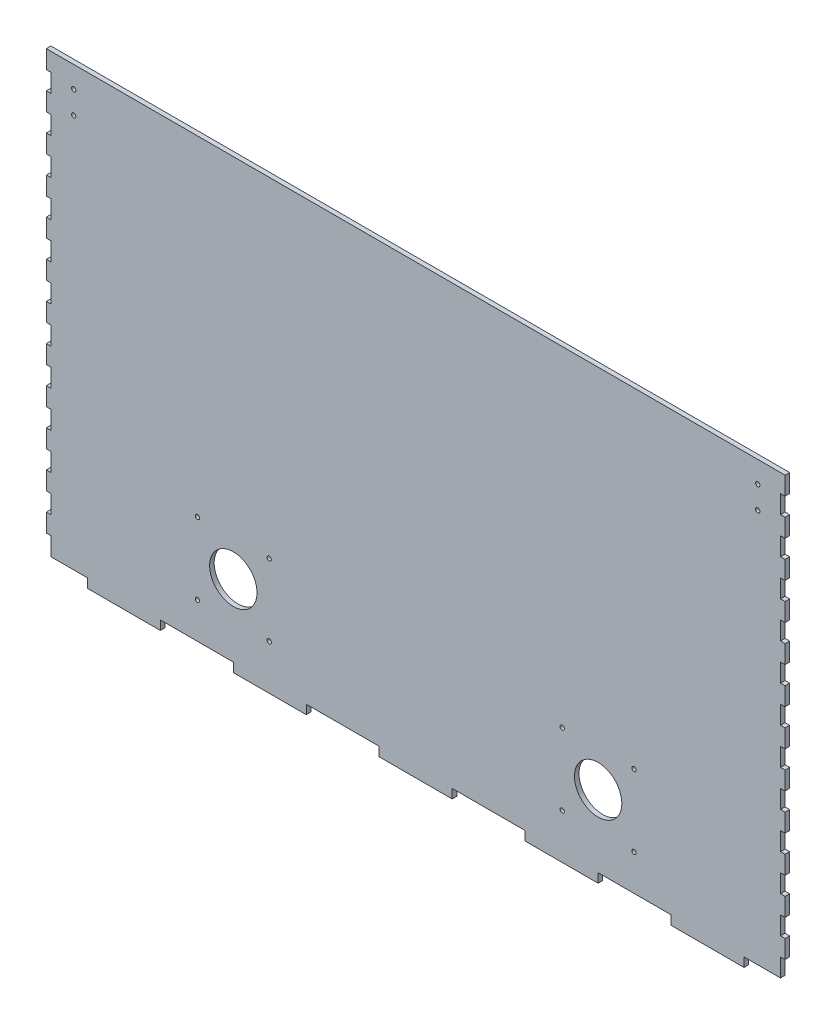
from build123d import *

# Parameters (mm, degrees)
SKETCH1_W           = 508
SKETCH1_H           = 304.8
SKETCH1_W_2         = 50.8
SKETCH1_H_2         = 6.35
SKETCH1_W_3         = 3.175
SKETCH1_H_3         = 12.7
BOSS_EXTRUDE1_DEPTH = 3.175
SKETCH2_R           = 16.5
SKETCH2_R_2         = 1.5
CUT_EXTRUDE1_DEPTH  = 3.175
SKETCH3_R           = 1.5
CUT_EXTRUDE2_DEPTH  = 3.175


with BuildPart() as part:
    # Sketch1 → Boss-Extrude1 (new body)
    with BuildSketch(Plane.XY):
        with Locations((254, 152.4)):
            Rectangle(SKETCH1_W, SKETCH1_H)
        with Locations((50.8, -3.175)):
            Rectangle(SKETCH1_W_2, SKETCH1_H_2)
        with Locations((152.4, -3.175)):
            Rectangle(SKETCH1_W_2, SKETCH1_H_2)
        with Locations((254, -3.175)):
            Rectangle(SKETCH1_W_2, SKETCH1_H_2)
        with Locations((355.6, -3.175)):
            Rectangle(SKETCH1_W_2, SKETCH1_H_2)
        with Locations((457.2, -3.175)):
            Rectangle(SKETCH1_W_2, SKETCH1_H_2)
        with Locations((-1.5875, 19.05)):
            Rectangle(SKETCH1_W_3, SKETCH1_H_3)
        with Locations((-1.5875, 44.45)):
            Rectangle(SKETCH1_W_3, SKETCH1_H_3)
        with Locations((-1.5875, 69.85)):
            Rectangle(SKETCH1_W_3, SKETCH1_H_3)
        with Locations((-1.5875, 95.25)):
            Rectangle(SKETCH1_W_3, SKETCH1_H_3)
        with Locations((-1.5875, 120.65)):
            Rectangle(SKETCH1_W_3, SKETCH1_H_3)
        with Locations((-1.5875, 146.05)):
            Rectangle(SKETCH1_W_3, SKETCH1_H_3)
        with Locations((-1.5875, 171.45)):
            Rectangle(SKETCH1_W_3, SKETCH1_H_3)
        with Locations((-1.5875, 196.85)):
            Rectangle(SKETCH1_W_3, SKETCH1_H_3)
        with Locations((-1.5875, 222.25)):
            Rectangle(SKETCH1_W_3, SKETCH1_H_3)
        with Locations((-1.5875, 247.65)):
            Rectangle(SKETCH1_W_3, SKETCH1_H_3)
        with Locations((-1.5875, 273.05)):
            Rectangle(SKETCH1_W_3, SKETCH1_H_3)
        with Locations((-1.5875, 298.45)):
            Rectangle(SKETCH1_W_3, SKETCH1_H_3)
        with Locations((509.5875, 19.05)):
            Rectangle(SKETCH1_W_3, SKETCH1_H_3)
        with Locations((509.5875, 44.45)):
            Rectangle(SKETCH1_W_3, SKETCH1_H_3)
        with Locations((509.5875, 69.85)):
            Rectangle(SKETCH1_W_3, SKETCH1_H_3)
        with Locations((509.5875, 95.25)):
            Rectangle(SKETCH1_W_3, SKETCH1_H_3)
        with Locations((509.5875, 146.05)):
            Rectangle(SKETCH1_W_3, SKETCH1_H_3)
        with Locations((509.5875, 120.65)):
            Rectangle(SKETCH1_W_3, SKETCH1_H_3)
        with Locations((509.5875, 171.45)):
            Rectangle(SKETCH1_W_3, SKETCH1_H_3)
        with Locations((509.5875, 196.85)):
            Rectangle(SKETCH1_W_3, SKETCH1_H_3)
        with Locations((509.5875, 222.25)):
            Rectangle(SKETCH1_W_3, SKETCH1_H_3)
        with Locations((509.5875, 247.65)):
            Rectangle(SKETCH1_W_3, SKETCH1_H_3)
        with Locations((509.5875, 273.05)):
            Rectangle(SKETCH1_W_3, SKETCH1_H_3)
        with Locations((509.5875, 298.45)):
            Rectangle(SKETCH1_W_3, SKETCH1_H_3)
    extrude(amount=BOSS_EXTRUDE1_DEPTH)

    # Sketch2 → Cut-Extrude1 (cut)
    with BuildSketch(Plane.XY.offset(3.175)):
        with Locations((127, 50)):
            Circle(SKETCH2_R)
        with Locations((102, 75)):
            Circle(SKETCH2_R_2)
        with Locations((152, 75)):
            Circle(SKETCH2_R_2)
        with Locations((152, 25)):
            Circle(SKETCH2_R_2)
        with Locations((102, 25)):
            Circle(SKETCH2_R_2)
        with Locations((381, 50)):
            Circle(SKETCH2_R)
        with Locations((356, 75)):
            Circle(SKETCH2_R_2)
        with Locations((356, 25)):
            Circle(SKETCH2_R_2)
        with Locations((406, 25)):
            Circle(SKETCH2_R_2)
        with Locations((406, 75)):
            Circle(SKETCH2_R_2)
    extrude(amount=-CUT_EXTRUDE1_DEPTH, mode=Mode.SUBTRACT)

    # Sketch3 → Cut-Extrude2 (cut)
    with BuildSketch(Plane.XY.offset(3.175)):
        with Locations((15.875, 289.8)):
            Circle(SKETCH3_R)
        with Locations((15.875, 274.05)):
            Circle(SKETCH3_R)
        with Locations((492.125, 289.8)):
            Circle(SKETCH3_R)
        with Locations((492.125, 274.05)):
            Circle(SKETCH3_R)
    extrude(amount=-CUT_EXTRUDE2_DEPTH, mode=Mode.SUBTRACT)


solid = part.part
